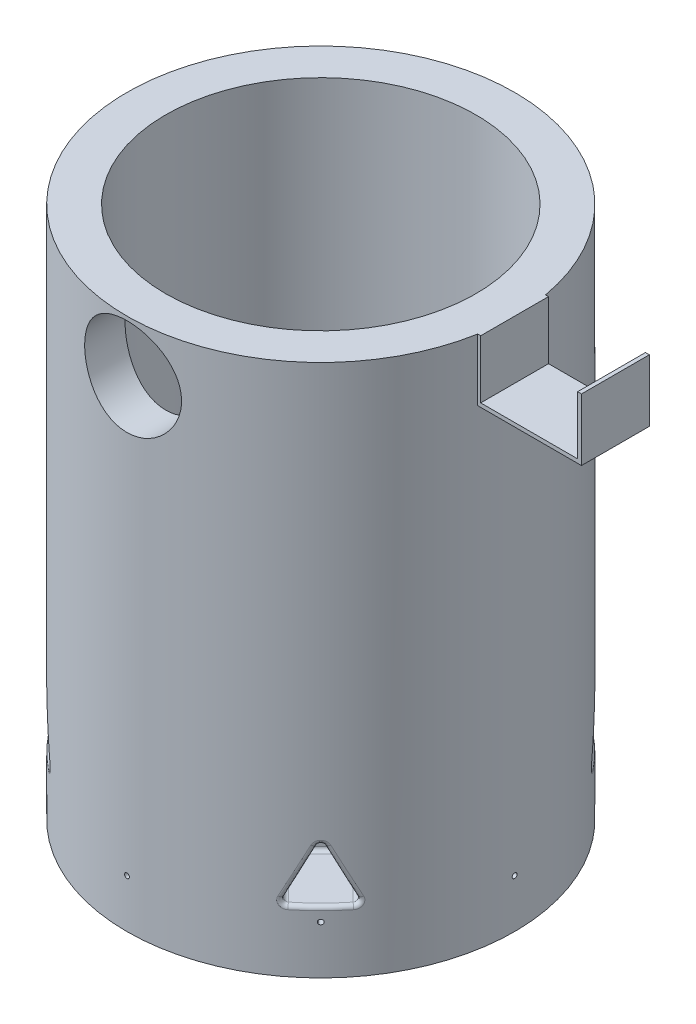
from build123d import *

# Parameters (mm, degrees)
SKETCH1_R               = 127
BOSS_EXTRUDE1_DEPTH     = 349.25
SKETCH4_R               = 101.6
CUT_EXTRUDE1_DEPTH      = 269.24
CUT_EXTRUDE3_REACH      = 452.134
CUT_EXTRUDE3_END_RADIUS = 101.6
SKETCH5_R               = 31.75
CUT_EXTRUDE4_START      = -38.1
SKETCH10_R              = 101.6
SKETCH10_R_2            = 86.36
CUT_EXTRUDE4_DEPTH      = 38.1
CIRPATTERN1_COUNT       = 8
CUT_EXTRUDE5_DEPTH      = 44.45
CIRPATTERN2_COUNT       = 4
EXTRUDE_THIN1_DEPTH     = 22.225
FILLET1_R               = 2.54


with BuildPart() as part:
    # Sketch1 → Boss-Extrude1 (new body)
    with BuildSketch(Plane(origin=(0, 0, 0), x_dir=(1, 0, 0), z_dir=(0, 1, 0))):
        with Locations(Location((0, 0, 0), (0, 0, 270))):
            Circle(SKETCH1_R)
    extrude(amount=BOSS_EXTRUDE1_DEPTH)

    # Sketch4 → Cut-Extrude1 (cut)
    with BuildSketch(Plane(origin=(0, 349.25, 0), x_dir=(1, 0, 0), z_dir=(0, 1, 0))):
        with Locations(Location((0, 0, 0), (0, 0, 270))):
            Circle(SKETCH4_R)
    extrude(amount=-CUT_EXTRUDE1_DEPTH, mode=Mode.SUBTRACT)

    # Cut-Extrude3: up to this cylinder (the profile starts outside it)
    cut_extrude3_end = Plane(origin=(0, 314.96, 0), z_dir=(0, 1, 0)) * Cylinder(CUT_EXTRUDE3_END_RADIUS, 1108.468, mode=Mode.PRIVATE)
    # Sketch5 → Cut-Extrude3 (cut, up to the surface)
    with BuildSketch(Plane.XY.offset(127), mode=Mode.PRIVATE) as cut_extrude3_sk1:
        with Locations((0, 314.96)):
            Circle(SKETCH5_R)
    cut_extrude3_tool1 = extrude(cut_extrude3_sk1.sketch, amount=-CUT_EXTRUDE3_REACH, mode=Mode.PRIVATE) - cut_extrude3_end
    add(cut_extrude3_tool1.solids().sort_by_distance((0, 314.96, 127))[0], mode=Mode.SUBTRACT)

    # Sketch9 → 1/8 (0.125) Diameter Hole1 (revolve, cut)
    with BuildSketch(Plane(origin=(0, 31.75, 127), x_dir=(0, -1, 0), z_dir=(1, 0, 0))):
        Polygon((0, 0), (0, 39.053866233), (1.5875, 38.1), (1.5875, 0), align=None)
    f_1_8_0_125_diameter_hole1 = revolve(axis=Axis((0, 31.75, 133.35), (0, 0, -1)), mode=Mode.SUBTRACT)

    # Sketch10 → Cut-Extrude4 (cut)
    with BuildSketch(Plane.XZ.offset(CUT_EXTRUDE4_START)):
        with Locations(Location((0, 0, 0), (0, 0, 90))):
            Circle(SKETCH10_R)
        with Locations(Location((0, 0, 0), (0, 0, 270))):
            Circle(SKETCH10_R_2, mode=Mode.SUBTRACT)
    extrude(amount=CUT_EXTRUDE4_DEPTH, mode=Mode.SUBTRACT)

    # CirPattern1: 1/8 (0.125) Diameter Hole1 ×8 about axis
    cirpattern1_axis = Axis((0, 349.25, 0), (0, -1, 0))
    for i in range(1, CIRPATTERN1_COUNT):
        add(f_1_8_0_125_diameter_hole1.rotate(cirpattern1_axis, i * 360 / CIRPATTERN1_COUNT), mode=Mode.SUBTRACT)

    # Sketch13 → Cut-Extrude5 (cut)
    with BuildSketch(Plane(origin=(89.802561211, 0, 89.802561211), x_dir=(0.7071067811865475, 0, -0.7071067811865477), z_dir=(0.7071067811865477, 0, 0.7071067811865475))):
        Polygon((-19.05, 40.64), (19.05, 40.64), (0, 78.74), align=None)
    cut_extrude5 = extrude(amount=-CUT_EXTRUDE5_DEPTH, mode=Mode.SUBTRACT)

    # CirPattern2: Cut-Extrude5 ×4 about axis
    cirpattern2_axis = Axis((0, 0, 0), (0, 1, 0))
    for i in range(1, CIRPATTERN2_COUNT):
        add(cut_extrude5.rotate(cirpattern2_axis, i * 360 / CIRPATTERN2_COUNT), mode=Mode.SUBTRACT)

    # Sketch14 → Extrude-Thin1 (add, symmetric)
    with BuildSketch(Plane.XY):
        Polygon((127, 349.25), (127, 311.15), (190.5, 311.15), (190.5, 349.25), (193.04, 349.25), (193.04, 308.61), (124.46, 308.61), (124.46, 349.25), align=None)
    extrude(amount=EXTRUDE_THIN1_DEPTH, both=True)

    # Fillet1
    fillet1_edges = [part.edges().sort_by_distance(p)[0] for p in [
        (96.28838601, 59.67911594, 82.810305636),
        (82.810305636, 59.67911594, 96.28838601),
        (60.108715579, 40.64, 87.049483942),
        (51.636472696, 59.69, 65.106856878),
        (74.087112999, 78.74, 74.087112999),
        (65.106856878, 59.69, 51.636472696),
        (87.049483942, 40.64, 60.108715579),
        (58.371664787, 40.64, 58.371664787),
        (89.802561211, 40.64, -89.802561211),
        (82.810305636, 59.67911594, -96.28838601),
        (96.28838601, 59.67911594, -82.810305636),
        (-89.802561211, 40.64, -89.802561211),
        (-96.28838601, 59.67911594, -82.810305636),
        (-82.810305636, 59.67911594, -96.28838601),
        (-89.802561211, 40.64, 89.802561211),
        (-82.810305636, 59.67911594, 96.28838601),
        (-96.28838601, 59.67911594, 82.810305636),
        (-87.049483942, 40.64, 60.108715579),
        (-65.106856878, 59.69, 51.636472696),
        (-74.087112999, 78.74, 74.087112999),
        (-51.636472696, 59.69, 65.106856878),
        (-60.108715579, 40.64, 87.049483942),
        (-58.371664787, 40.64, 58.371664787),
        (-60.108715579, 40.64, -87.049483942),
        (-51.636472696, 59.69, -65.106856878),
        (-74.087112999, 78.74, -74.087112999),
        (-65.106856878, 59.69, -51.636472696),
        (-87.049483942, 40.64, -60.108715579),
        (-58.371664787, 40.64, -58.371664787),
        (87.049483942, 40.64, -60.108715579),
        (65.106856878, 59.69, -51.636472696),
        (74.087112999, 78.74, -74.087112999),
        (51.636472696, 59.69, -65.106856878),
        (60.108715579, 40.64, -87.049483942),
        (58.371664787, 40.64, -58.371664787),
        (89.802561211, 40.64, 89.802561211),
    ]]
    fillet(fillet1_edges, radius=FILLET1_R)


solid = part.part
